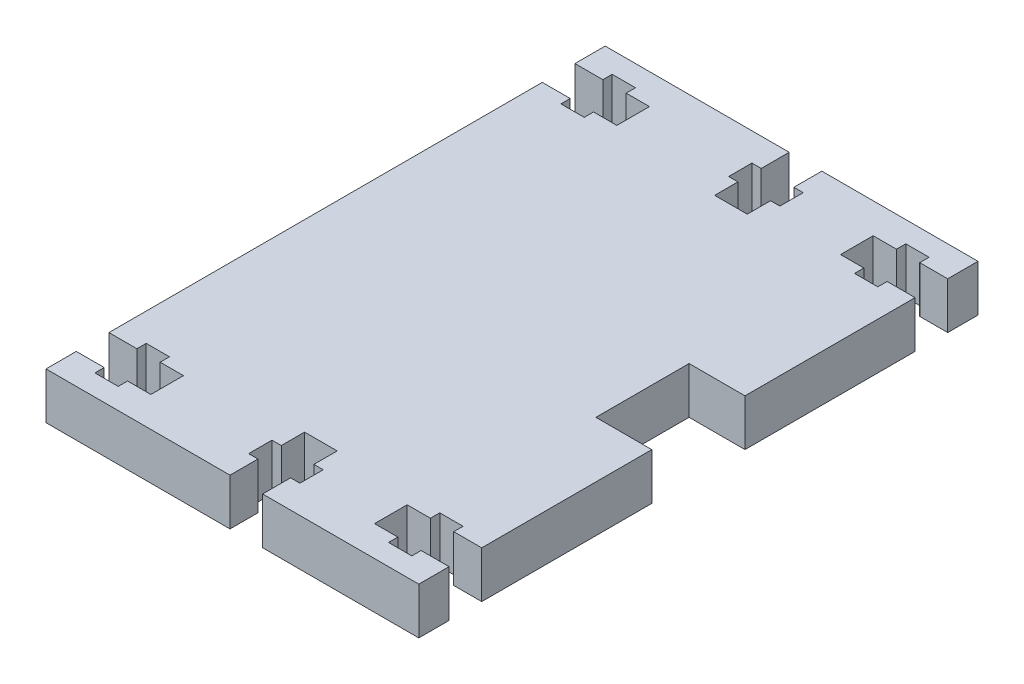
from build123d import *

# Parameters (mm, degrees)
EXTRUDE_1_DEPTH     = 5
CUT_EXTRUDE_1_DEPTH = 5


with BuildPart() as part:
    # 草图1 → 凸台-拉伸1 (new body)
    with BuildSketch(Plane(origin=(0, 0, 0), x_dir=(1, 0, 0), z_dir=(0, 1, 0))):
        Polygon((-19.743275532, 30), (-19.743275532, 26.75), (-16.743275532, 26.75), (-16.743275532, 27.75), (-14.243275532, 27.75), (-14.243275532, 26.75), (-11.743275532, 26.75), (-11.743275532, 23.25), (-14.243275532, 23.25), (-14.243275532, 22.25), (-16.743275532, 22.25), (-16.743275532, 23.25), (-19.743275532, 23.25), (-19.743275532, -23.25), (-16.743275532, -23.25), (-16.743275532, -22.25), (-14.243275532, -22.25), (-14.243275532, -23.25), (-11.743275532, -23.25), (-11.743275532, -26.75), (-14.243275532, -26.75), (-14.243275532, -27.75), (-16.743275532, -27.75), (-16.743275532, -26.75), (-19.743275532, -26.75), (-19.743275532, -30), (20.256724468, -30), (20.256724468, -26.75), (17.256724468, -26.75), (17.256724468, -27.75), (14.756724468, -27.75), (14.756724468, -26.75), (12.256724468, -26.75), (12.256724468, -23.25), (14.756724468, -23.25), (14.756724468, -22.25), (17.256724468, -22.25), (17.256724468, -23.25), (20.256724468, -23.25), (20.256724468, -5), (14.256724468, -5), (14.256724468, 5), (20.256724468, 5), (20.256724468, 23.25), (17.256724468, 23.25), (17.256724468, 22.25), (14.756724468, 22.25), (14.756724468, 23.25), (12.256724468, 23.25), (12.256724468, 26.75), (14.756724468, 26.75), (14.756724468, 27.75), (17.256724468, 27.75), (17.256724468, 26.75), (20.256724468, 26.75), (20.256724468, 30), align=None)
    extrude(amount=EXTRUDE_1_DEPTH)

    # 草图2 → 切除-拉伸1 (cut)
    with BuildSketch(Plane(origin=(0, 5, 0), x_dir=(1, 0, 0), z_dir=(0, 1, 0))):
        Polygon((0, 30), (0, 27), (-1, 27), (-1, 24.5), (0, 24.5), (0, 22), (3.5, 22), (3.5, 24.5), (4.5, 24.5), (4.5, 27), (3.5, 27), (3.5, 30), align=None)
        Polygon((3.5, -30), (0, -30), (0, -27), (-1, -27), (-1, -24.5), (0, -24.5), (0, -22), (3.5, -22), (3.5, -24.5), (4.5, -24.5), (4.5, -27), (3.5, -27), align=None)
    extrude(amount=-CUT_EXTRUDE_1_DEPTH, mode=Mode.SUBTRACT)


solid = part.part
